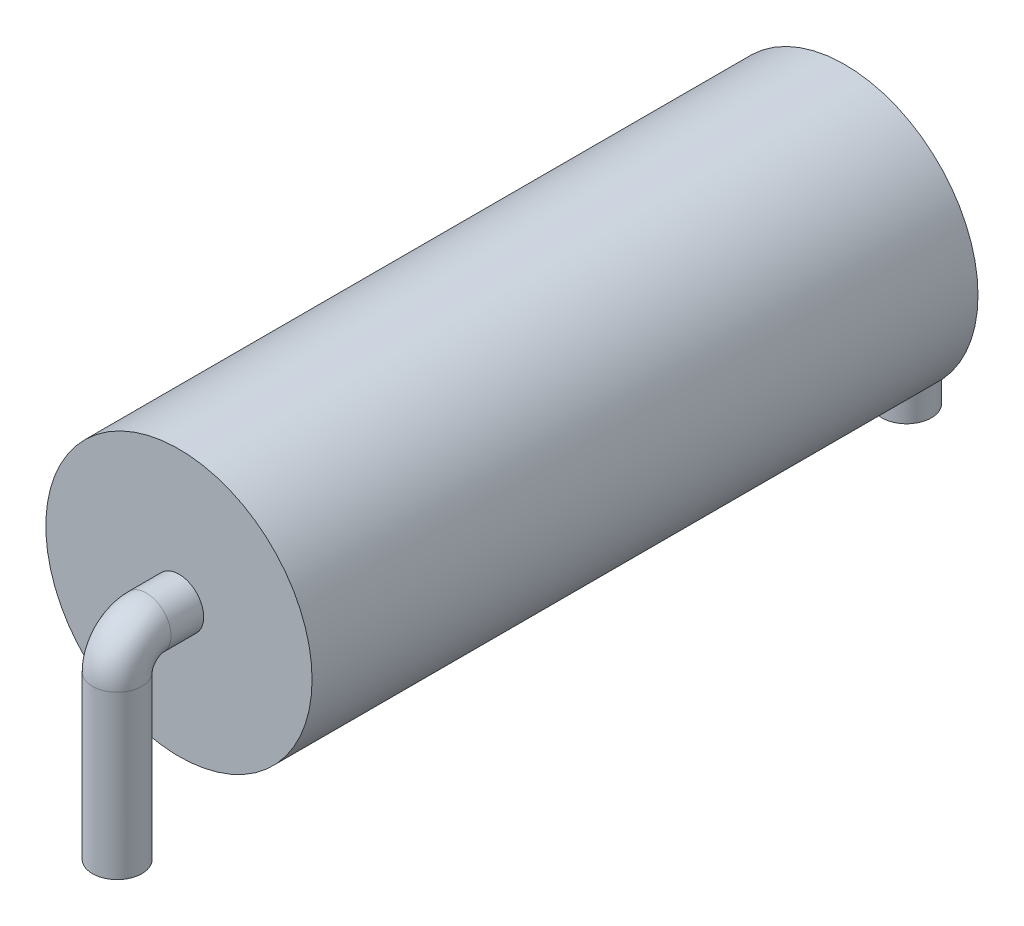
from build123d import *

# Parameters (mm, degrees)
SKETCH1_R           = 2.285
BOSS_EXTRUDE1_DEPTH = 5.715
SWEEP1_PROFILE_R    = 0.425


with BuildPart() as part:
    # Sketch1 → Boss-Extrude1 (new, symmetric)
    with BuildSketch(Plane.XY):
        Circle(SKETCH1_R)
    extrude(amount=BOSS_EXTRUDE1_DEPTH, both=True)

    # Sweep1: sweep along a path in Sketch2
    with BuildLine(Plane(origin=(0, 0, 0), x_dir=(0, 0, -1), z_dir=(1, 0, 0))) as sweep1_path:
        Line((-6.775, -3.285), (-6.775, -0.5))
        ThreePointArc((-6.775, -0.5), (-6.628553391, -0.146446609), (-6.275, 0))
        Line((-6.275, 0), (6.275, 0))
        ThreePointArc((6.275, 0), (6.628553391, -0.146446609), (6.775, -0.5))
        Line((6.775, -0.5), (6.775, -3.285))
    # Sweep1 profile (on start of the path) → Sweep1 (sweep)
    with BuildSketch(Plane(origin=(0, -3.285, 6.775), x_dir=(0, 0, 1), z_dir=(0, 1, 0))):
        Circle(SWEEP1_PROFILE_R)
    sweep(path=sweep1_path.line)


solid = part.part
